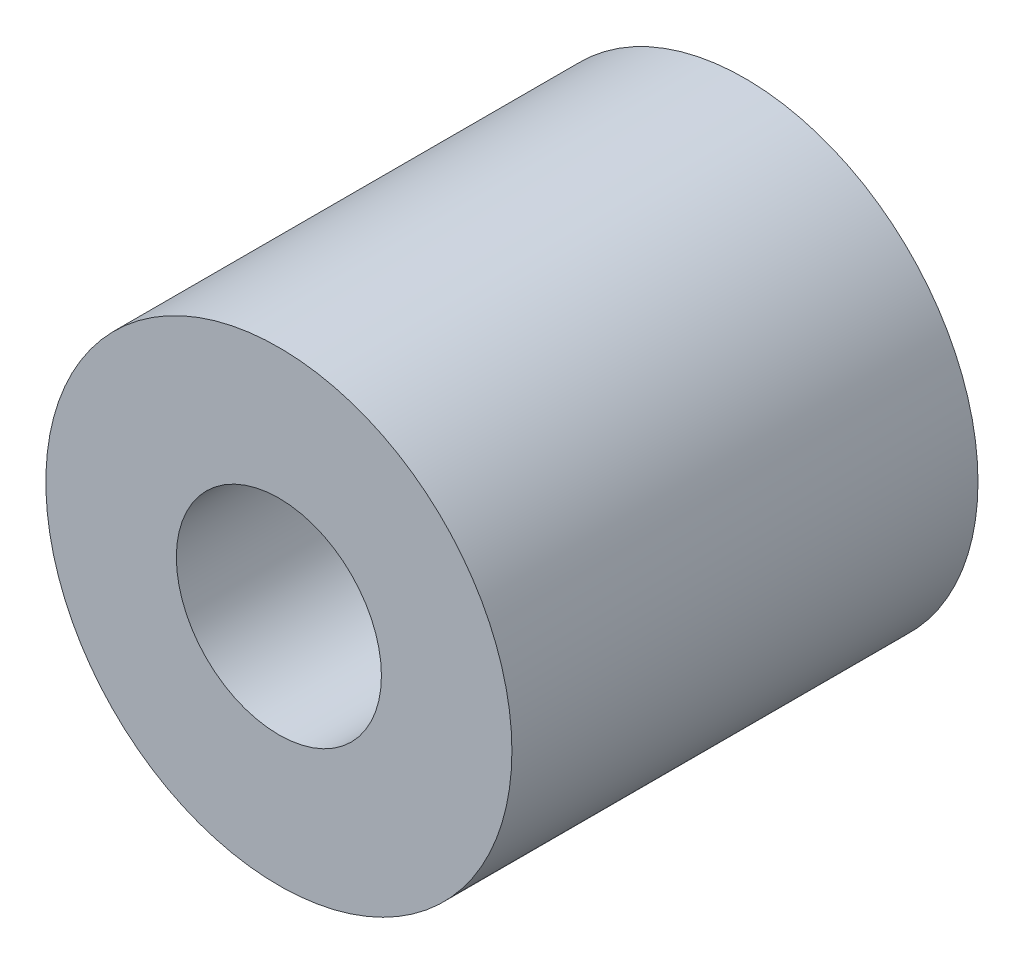
from build123d import *

# Parameters (mm, degrees)
SPACER_RING_SKETCH_R   = 5
SPACER_RING_SKETCH_R_2 = 2.2
SPACER_RING_DEPTH      = 10


with BuildPart() as part:
    # Spacer ring sketch → Spacer ring (new body)
    with BuildSketch(Plane.XY.offset(-51)):
        with Locations((-57.291651246, -7)):
            Circle(SPACER_RING_SKETCH_R)
        with Locations((-57.291651246, -7)):
            Circle(SPACER_RING_SKETCH_R_2, mode=Mode.SUBTRACT)
    extrude(amount=SPACER_RING_DEPTH)


solid = part.part
